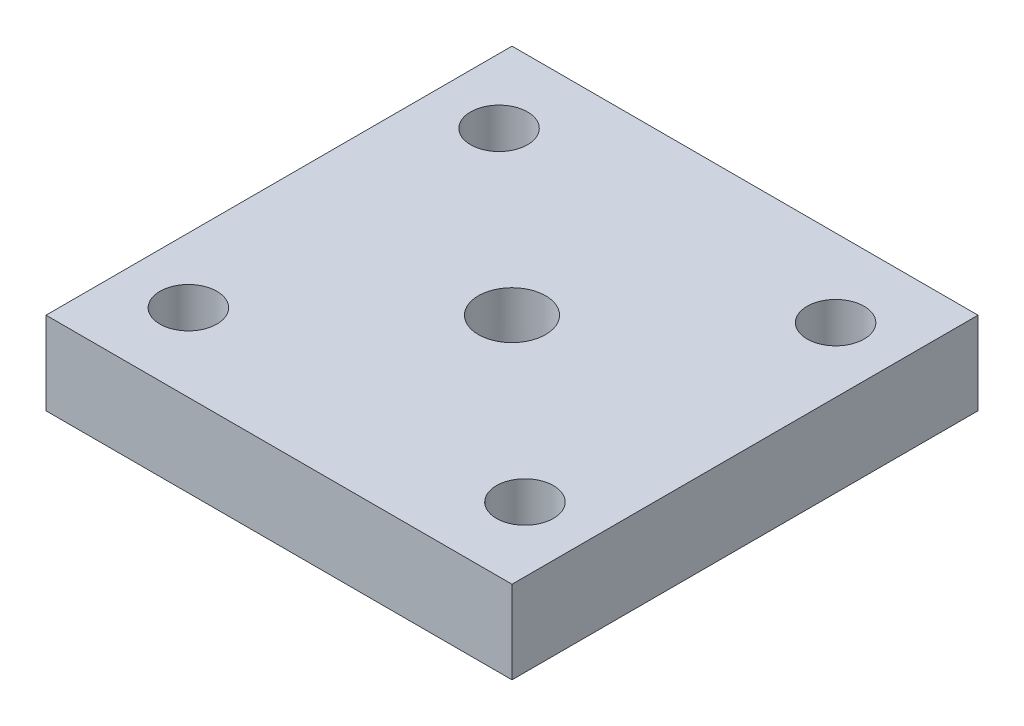
from build123d import *

# Parameters (mm, degrees)
SKETCH_1_W          = 45
SKETCH_1_H          = 45
EXTRUDE_1_DEPTH     = 8
SKETCH_2_R          = 2.75
CUT_EXTRUDE_1_DEPTH = 8
SKETCH_3_R          = 3.25
CUT_EXTRUDE_2_DEPTH = 8
SKETCH_4_R          = 7
CUT_EXTRUDE_3_DEPTH = 3


with BuildPart() as part:
    # 草图1 → 凸台-拉伸1 (new body)
    with BuildSketch(Plane(origin=(0, 0, 0), x_dir=(1, 0, 0), z_dir=(0, 1, 0))):
        Rectangle(SKETCH_1_W, SKETCH_1_H)
    extrude(amount=EXTRUDE_1_DEPTH)

    # 草图2 → 切除-拉伸1 (cut)
    with BuildSketch(Plane(origin=(0, 8, 0), x_dir=(1, 0, 0), z_dir=(0, 1, 0))):
        with Locations(Location((-16.25, 15, 0), (0, 0, 270))):
            Circle(SKETCH_2_R)
        with Locations(Location((16.25, 15, 0), (0, 0, 270))):
            Circle(SKETCH_2_R)
        with Locations(Location((16.25, -15, 0), (0, 0, 270))):
            Circle(SKETCH_2_R)
        with Locations(Location((-16.25, -15, 0), (0, 0, 270))):
            Circle(SKETCH_2_R)
    extrude(amount=-CUT_EXTRUDE_1_DEPTH, mode=Mode.SUBTRACT)

    # 草图3 → 切除-拉伸2 (cut)
    with BuildSketch(Plane(origin=(0, 8, 0), x_dir=(1, 0, 0), z_dir=(0, 1, 0))):
        with Locations(Location((0, 0, 0), (0, 0, 270))):
            Circle(SKETCH_3_R)
    extrude(amount=-CUT_EXTRUDE_2_DEPTH, mode=Mode.SUBTRACT)

    # 草图4 → 切除-拉伸3 (cut)
    with BuildSketch(Plane.XZ):
        with Locations(Location((0, 0, 0), (0, 0, 270))):
            Circle(SKETCH_4_R)
    extrude(amount=-CUT_EXTRUDE_3_DEPTH, mode=Mode.SUBTRACT)


solid = part.part
